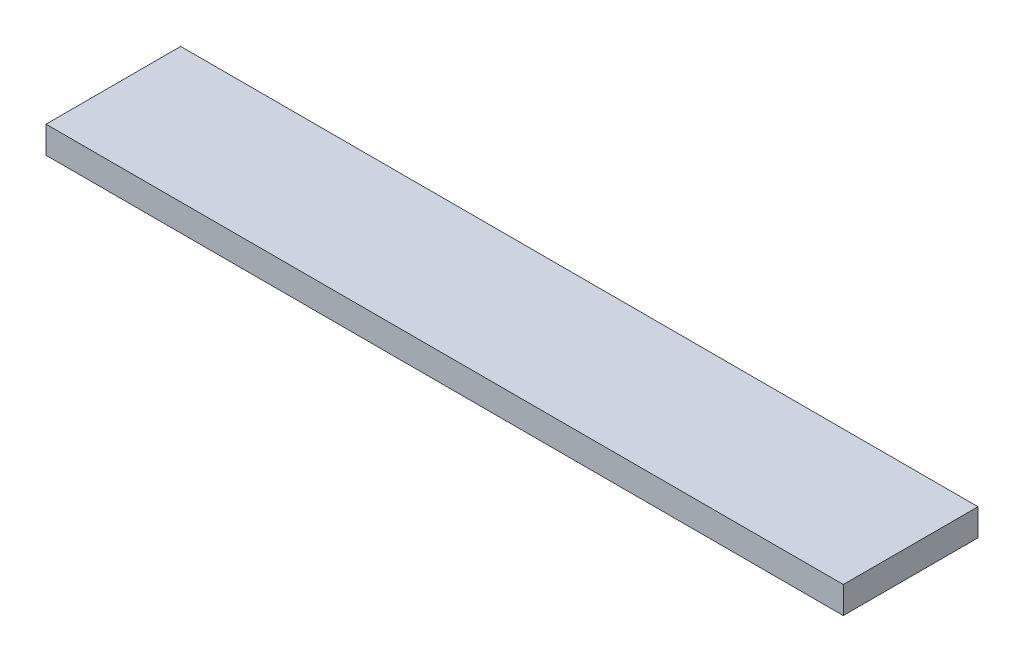
from build123d import *

# Parameters (mm, degrees)
SKETCH1_W           = 296
SKETCH1_H           = 50
BOSS_EXTRUDE1_DEPTH = 10


with BuildPart() as part:
    # Sketch1 → Boss-Extrude1 (new body)
    with BuildSketch(Plane(origin=(0, 0, 0), x_dir=(1, 0, 0), z_dir=(0, 1, 0))):
        Rectangle(SKETCH1_W, SKETCH1_H)
    extrude(amount=BOSS_EXTRUDE1_DEPTH)


solid = part.part
